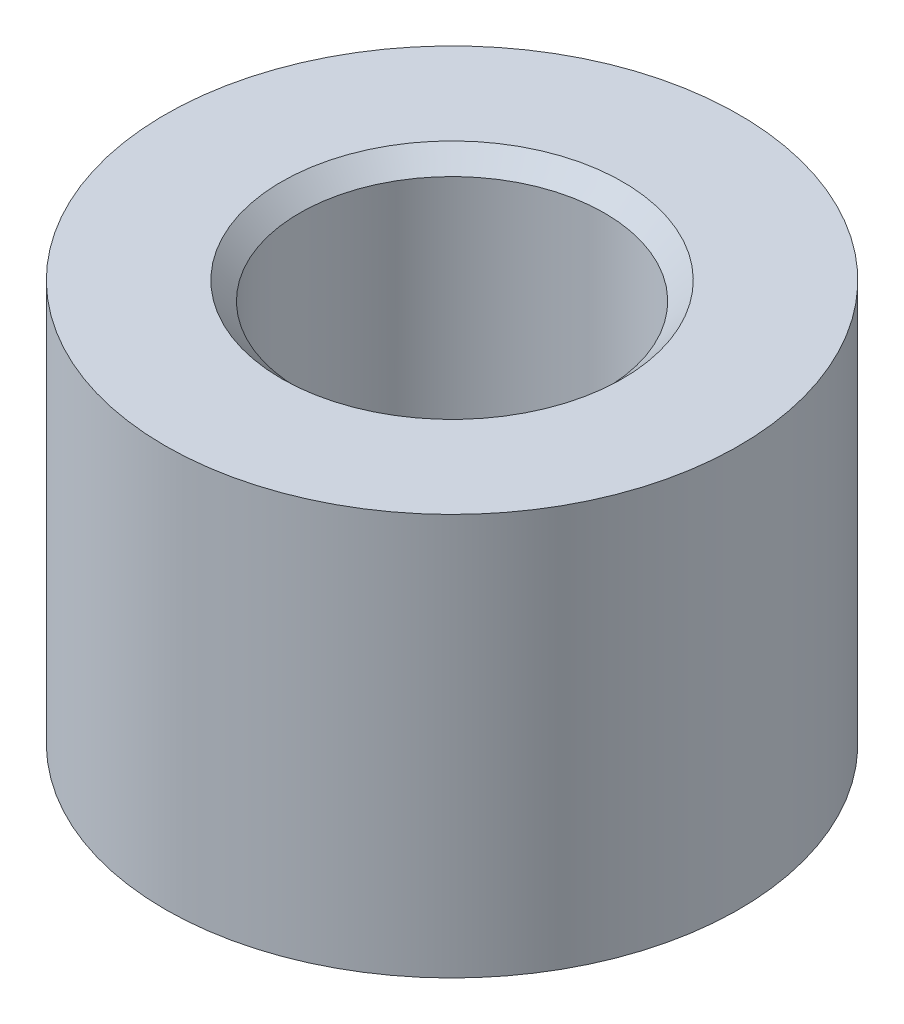
from build123d import *

# Parameters (mm, degrees)
SKETCH1_R           = 6.35
SKETCH1_R_2         = 3.375
BOSS_EXTRUDE1_DEPTH = 8.885072
CHAMFER1_SIZE       = 0.4


with BuildPart() as part:
    # Sketch1 → Boss-Extrude1 (new body)
    with BuildSketch(Plane(origin=(0, 0, 0), x_dir=(1, 0, 0), z_dir=(0, 1, 0))):
        with Locations(Location((0, 0, 0), (0, 0, 270))):
            Circle(SKETCH1_R)
        with Locations(Location((0, 0, 0), (0, 0, 270))):
            Circle(SKETCH1_R_2, mode=Mode.SUBTRACT)
    extrude(amount=BOSS_EXTRUDE1_DEPTH)

    # Chamfer1
    chamfer1_edges = [part.edges().sort_by_distance(p)[0] for p in [
        (0, 0, -3.375),
        (0, 8.885072, -3.375),
    ]]
    chamfer(chamfer1_edges, length=CHAMFER1_SIZE)


solid = part.part
